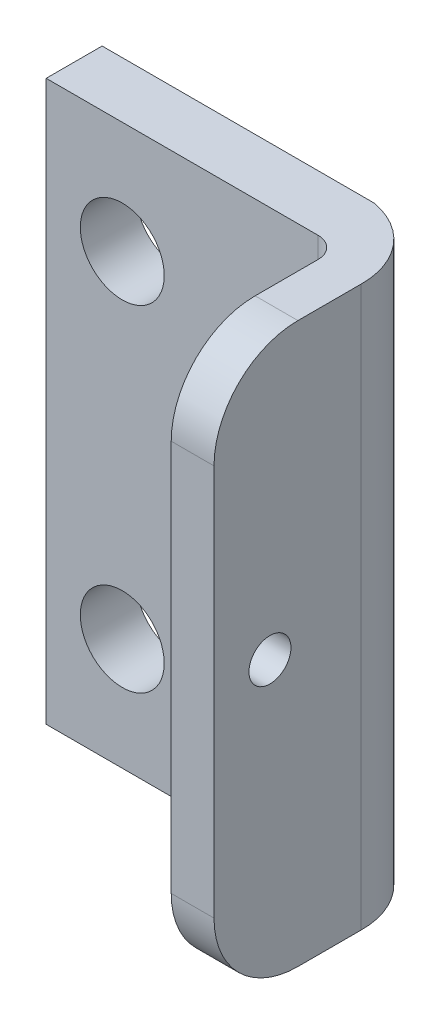
from build123d import *

# Parameters (mm, degrees)
SKETCH1_W           = 9.72
SKETCH1_H           = 20
SKETCH1_R           = 1.5
BOSS_EXTRUDE1_DEPTH = 2
BOSS_EXTRUDE2_DEPTH = 20
SKETCH3_R           = 0.75
BOSS_EXTRUDE3_DEPTH = 1.53


with BuildPart() as part:
    # Sketch1 → Boss-Extrude1 (new body)
    with BuildSketch(Plane.XY):
        with Locations((4.86, 10)):
            Rectangle(SKETCH1_W, SKETCH1_H)
        with Locations((2.72, 16)):
            Circle(SKETCH1_R, mode=Mode.SUBTRACT)
        with Locations((2.72, 4)):
            Circle(SKETCH1_R, mode=Mode.SUBTRACT)
    extrude(amount=BOSS_EXTRUDE1_DEPTH)

    # Sketch2 → Boss-Extrude2 (add)
    with BuildSketch(Plane.XZ):
        with BuildLine():
            Line((9.72, 2), (9.72, 0))
            ThreePointArc((9.72, 0), (11.367131495, 0.954473399), (11.999702326, 2.75))
            Line((11.999702326, 2.75), (10.47, 2.75))
            ThreePointArc((10.47, 2.75), (10.250330086, 2.219669914), (9.72, 2))
        make_face()
    extrude(amount=-BOSS_EXTRUDE2_DEPTH)

    # Sketch3 → Boss-Extrude3 (add)
    with BuildSketch(Plane(origin=(12, 0, 0), x_dir=(0, 0, -1), z_dir=(1, 0, 0))):
        with BuildLine():
            Line((-2.75, 20), (-5, 20))
            ThreePointArc((-5, 20), (-7.121320344, 19.121320344), (-8, 17))
            Line((-8, 17), (-8, 3))
            ThreePointArc((-8, 3), (-7.121320344, 0.878679656), (-5, 0))
            Line((-5, 0), (-2.75, 0))
            Line((-2.75, 0), (-2.75, 20))
        make_face()
        with Locations((-6, 10)):
            Circle(SKETCH3_R, mode=Mode.SUBTRACT)
    extrude(amount=-BOSS_EXTRUDE3_DEPTH)


solid = part.part
